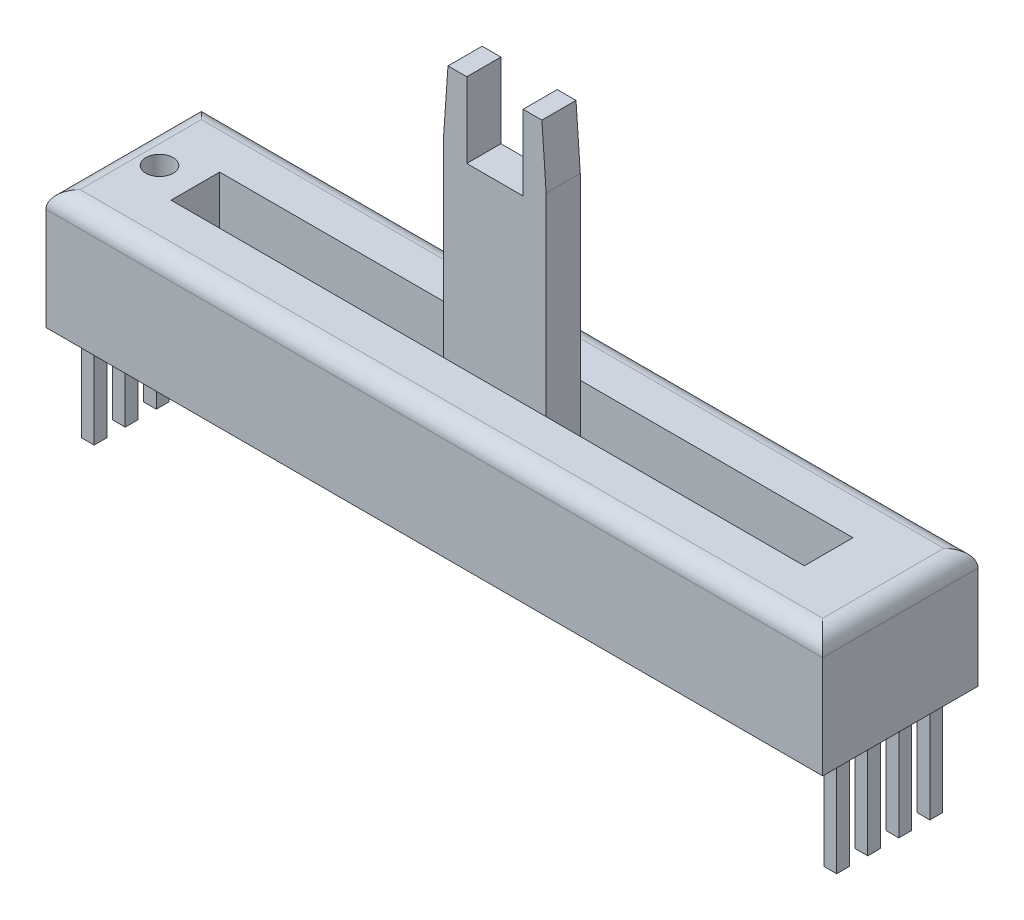
from build123d import *
from OCP.BRepFilletAPI import BRepFilletAPI_MakeChamfer

# Parameters (mm, degrees)
SKETCH1_W           = 45.5
SKETCH1_H           = 9.1
BOSS_EXTRUDE1_DEPTH = 7
SKETCH2_W           = 37.1
SKETCH2_H           = 2.85
CUT_EXTRUDE1_DEPTH  = 5
SKETCH3_R           = 0.8
CUT_EXTRUDE2_DEPTH  = 5
FILLET1_R           = 1
SKETCH4_W           = 0.75
SKETCH4_H           = 0.75
BOSS_EXTRUDE2_DEPTH = 6
SKETCH5_W           = 6
SKETCH5_H           = 2
BOSS_EXTRUDE3_DEPTH = 19.5
CUT_EXTRUDE3_REACH  = 33.79
SKETCH6_W           = 3.3
SKETCH6_H           = 4.4
CHAMFER1_SIZE       = 0.25
CHAMFER1_SIZE2      = 3.575166564


with BuildPart() as part:
    # Sketch1 → Boss-Extrude1 (new body)
    with BuildSketch(Plane(origin=(0, 0, 0), x_dir=(1, 0, 0), z_dir=(0, 1, 0))):
        Rectangle(SKETCH1_W, SKETCH1_H)
    extrude(amount=BOSS_EXTRUDE1_DEPTH)

    # Sketch2 → Cut-Extrude1 (cut)
    with BuildSketch(Plane(origin=(0, 7, 0), x_dir=(1, 0, 0), z_dir=(0, 1, 0))):
        Rectangle(SKETCH2_W, SKETCH2_H)
    extrude(amount=-CUT_EXTRUDE1_DEPTH, mode=Mode.SUBTRACT)

    # Sketch3 → Cut-Extrude2 (cut)
    with BuildSketch(Plane(origin=(0, 7, 0), x_dir=(1, 0, 0), z_dir=(0, 1, 0))):
        with Locations(Location((-20.65, 0, 0), (0, 0, 270))):
            Circle(SKETCH3_R)
    extrude(amount=-CUT_EXTRUDE2_DEPTH, mode=Mode.SUBTRACT)

    # Fillet1
    fillet1_edges = [part.edges().sort_by_distance(p)[0] for p in [
        (-22.75, 7, 0),
        (0, 7, 4.55),
        (22.75, 7, 0),
        (0, 7, -4.55),
    ]]
    fillet(fillet1_edges, radius=FILLET1_R)

    # Sketch4 → Boss-Extrude2 (add)
    with BuildSketch(Plane.XZ):
        with Locations((-21.75, 2.73)):
            Rectangle(SKETCH4_W, SKETCH4_H)
        with Locations((-21.75, 0.91)):
            Rectangle(SKETCH4_W, SKETCH4_H)
        with Locations((-21.75, -0.91)):
            Rectangle(SKETCH4_W, SKETCH4_H)
        with Locations((-21.75, -2.73)):
            Rectangle(SKETCH4_W, SKETCH4_H)
    boss_extrude2 = extrude(amount=BOSS_EXTRUDE2_DEPTH)

    # Mirror1: Boss-Extrude2 across plane
    add(boss_extrude2.mirror(Plane(origin=(0, 0, 0), x_dir=(0, 0, 1), z_dir=(1, 0, 0))))

    # Sketch5 → Boss-Extrude3 (add)
    with BuildSketch(Plane(origin=(0, 2, 0), x_dir=(1, 0, 0), z_dir=(0, 1, 0))):
        Rectangle(SKETCH5_W, SKETCH5_H)
    extrude(amount=BOSS_EXTRUDE3_DEPTH)

    # Sketch6 → Cut-Extrude3 (cut, up to next)
    with BuildSketch(Plane.XY.offset(1), mode=Mode.PRIVATE) as cut_extrude3_sk1:
        with Locations((0, 19.3)):
            Rectangle(SKETCH6_W, SKETCH6_H)
    cut_extrude3_tool1 = extrude(cut_extrude3_sk1.sketch, amount=-CUT_EXTRUDE3_REACH, mode=Mode.PRIVATE) & part.part
    add(cut_extrude3_tool1.solids().sort_by_distance((0, 19.3, 1))[0], mode=Mode.SUBTRACT)

    # Chamfer1: one chamfer whose edges measure the first distance from different faces: ONE call of the kernel's chamfer builder (chamfer() names one face for all edges)
    chamfer1_edges_1 = [part.edges().sort_by_distance(p)[0] for p in [
        (-3, 21.5, 0),
    ]]
    chamfer1_side_1 = [part.faces().sort_by_distance(p)[0] for p in [
        (-2.325, 21.5, 0),
    ]]
    chamfer1_edges_2 = [part.edges().sort_by_distance(p)[0] for p in [
        (3, 21.5, 0),
    ]]
    chamfer1_side_2 = [part.faces().sort_by_distance(p)[0] for p in [
        (2.325, 21.5, 0),
    ]]
    chamfer1 = BRepFilletAPI_MakeChamfer(part.part.solid().wrapped)
    for e in chamfer1_edges_1:
        chamfer1.Add(CHAMFER1_SIZE, CHAMFER1_SIZE2, e.wrapped, chamfer1_side_1[0].wrapped)  # the first distance lies on this face
    for e in chamfer1_edges_2:
        chamfer1.Add(CHAMFER1_SIZE, CHAMFER1_SIZE2, e.wrapped, chamfer1_side_2[0].wrapped)  # the first distance lies on this face
    add(Compound.cast(chamfer1.Shape()), mode=Mode.REPLACE)


solid = part.part
